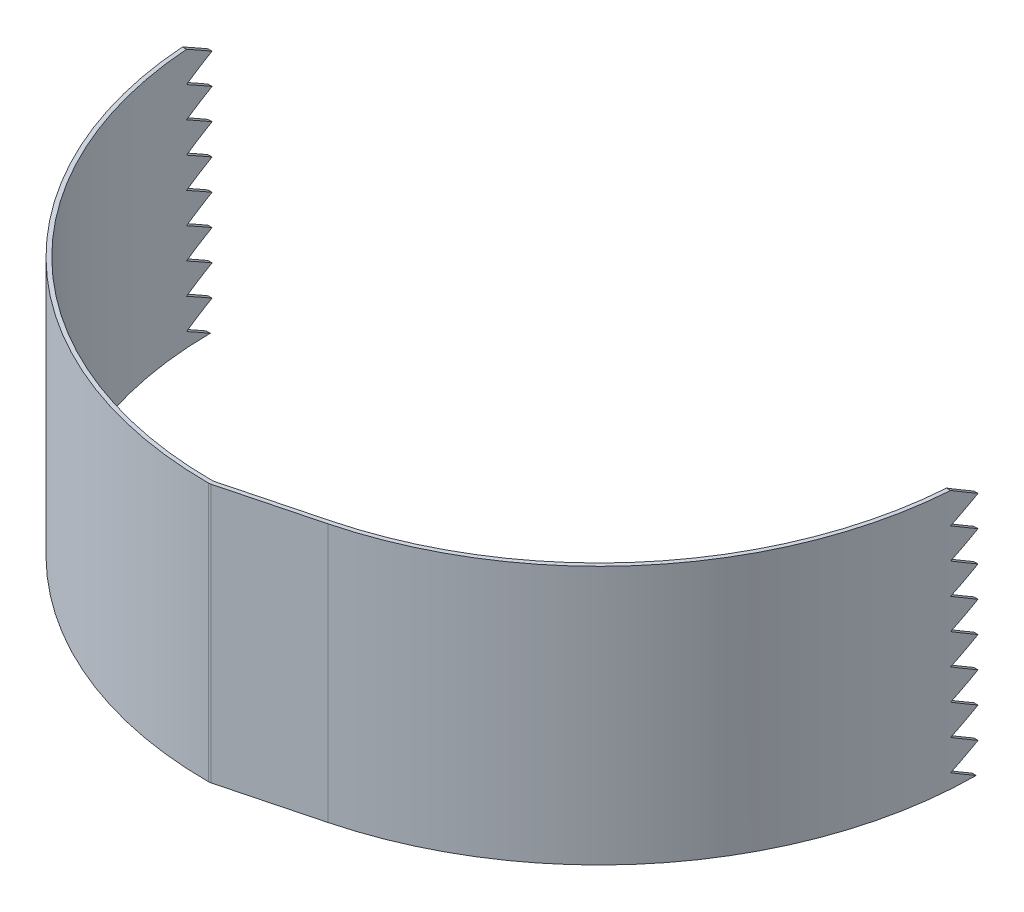
from build123d import *

# Parameters (mm, degrees)
BOSS_EXTRUDE1_DEPTH     = 3.175
CUT_EXTRUDE1_DEPTH      = 14.942762459
CUT_EXTRUDE1_DEPTH_BACK = 14.942762459


with BuildPart() as part:
    # Sketch1 → Boss-Extrude1 (new, symmetric)
    with BuildSketch(Plane(origin=(0, 0, 0), x_dir=(1, 0, 0), z_dir=(0, 1, 0))):
        with BuildLine():
            Line((0.050388708, -9.493548387), (2.317880549, -8.903225806))
            ThreePointArc((2.317880549, -8.903225806), (7.278890748, -5.62652197), (9.2, 0))
            Line((9.2, 0), (9.3, 0))
            ThreePointArc((9.3, 0), (7.358009126, -5.687679817), (2.343074903, -9))
            Line((2.343074903, -9), (0.063226066, -9.593539621))
            ThreePointArc((0.063226066, -9.593539621), (0.03837284, -9.598354384), (0.013110494, -9.599991048))
            ThreePointArc((0.013110494, -9.599991048), (-6.783588256, -6.792858777), (-9.6, 0))
            Line((-9.6, 0), (-9.5, 0))
            ThreePointArc((-9.5, 0), (-6.717514421, -6.717514421), (0, -9.5))
            ThreePointArc((0, -9.5), (0.025400025, -9.49838054), (0.050388708, -9.493548387))
        make_face()
    extrude(amount=BOSS_EXTRUDE1_DEPTH, both=True)

    # Sketch2 → Cut-Extrude1 (cut, two sides: drawn at the far end of the back side and taken through both)
    with BuildSketch(Plane(origin=(0, 0, 0), x_dir=(0, 0, -1), z_dir=(1, 0, 0)).offset(-CUT_EXTRUDE1_DEPTH_BACK)):
        Polygon((0, 3.55), (0, 2.8), (-0.649519053, 3.175), align=None)
        Polygon((0, 2.8), (0, 2.05), (-0.649519053, 2.425), align=None)
        Polygon((0, 2.05), (0, 1.3), (-0.649519053, 1.675), align=None)
        Polygon((0, 1.3), (0, 0.55), (-0.649519053, 0.925), align=None)
        Polygon((0, 0.55), (0, -0.2), (-0.649519053, 0.175), align=None)
        Polygon((0, -0.2), (0, -0.95), (-0.649519053, -0.575), align=None)
        Polygon((0, -0.95), (0, -1.7), (-0.649519053, -1.325), align=None)
        Polygon((0, -1.7), (0, -2.45), (-0.649519053, -2.075), align=None)
        Polygon((0, -2.45), (0, -3.2), (-0.649519053, -2.825), align=None)
    extrude(amount=CUT_EXTRUDE1_DEPTH + CUT_EXTRUDE1_DEPTH_BACK, mode=Mode.SUBTRACT)


solid = part.part
